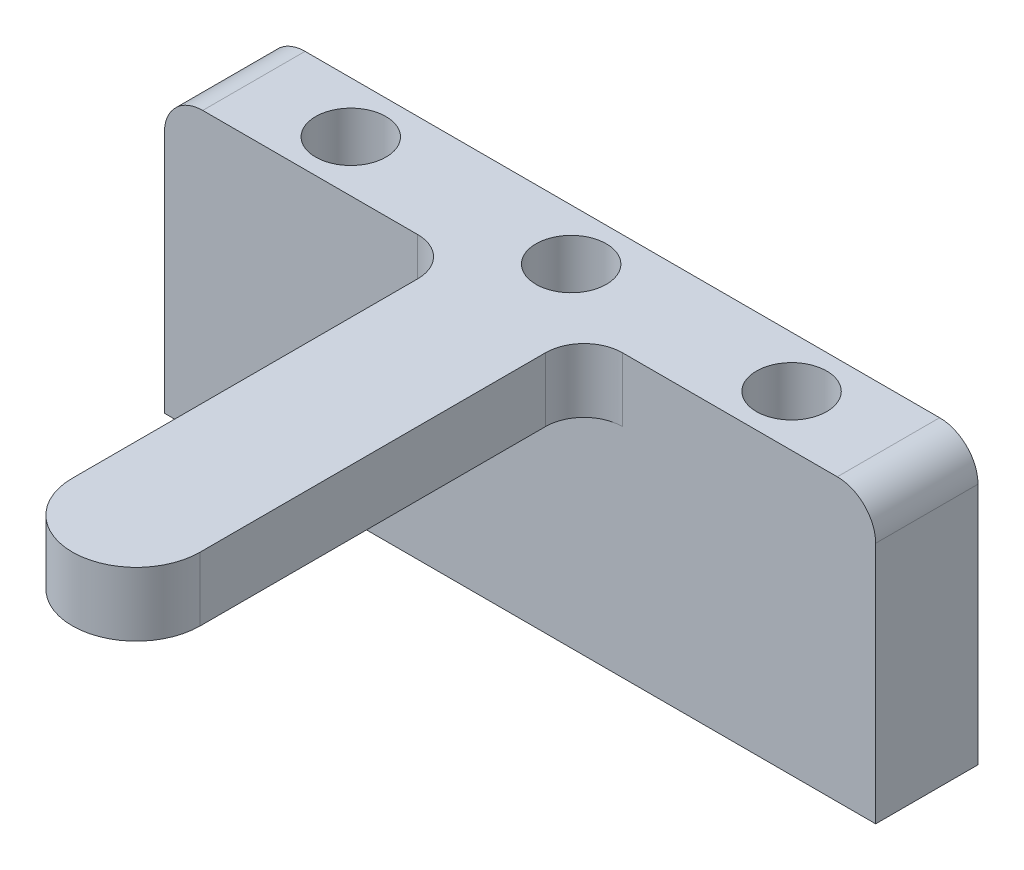
from build123d import *

# Parameters (mm, degrees)
SKETCH1_W           = 55.61
SKETCH1_H           = 8
SKETCH1_R           = 2.75
BOSS_EXTRUDE1_DEPTH = 22
SKETCH2_W           = 5
SKETCH2_H           = 5
BOSS_EXTRUDE2_DEPTH = 30
BOSS_EXTRUDE3_DEPTH = 5
FILLET1_R           = 3


with BuildPart() as part:
    # Sketch1 → Boss-Extrude1 (new body)
    with BuildSketch(Plane(origin=(0, 0, 0), x_dir=(1, 0, 0), z_dir=(0, 1, 0))):
        with Locations((27.805, 4)):
            Rectangle(SKETCH1_W, SKETCH1_H)
        with Locations(Location((27.805, 4, 0), (0, 0, 270))):
            Circle(SKETCH1_R, mode=Mode.SUBTRACT)
        with Locations(Location((10.575, 4, 0), (0, 0, 270))):
            Circle(SKETCH1_R, mode=Mode.SUBTRACT)
        with Locations(Location((45.035, 4, 0), (0, 0, 270))):
            Circle(SKETCH1_R, mode=Mode.SUBTRACT)
    extrude(amount=BOSS_EXTRUDE1_DEPTH)

    # Sketch2 → Boss-Extrude2 (add)
    with BuildSketch(Plane.XY):
        with Locations((25.305, 19.5)):
            Rectangle(SKETCH2_W, SKETCH2_H)
        with Locations((30.305, 19.5)):
            Rectangle(SKETCH2_W, SKETCH2_H)
    extrude(amount=BOSS_EXTRUDE2_DEPTH)

    # Sketch3 → Boss-Extrude3 (add)
    with BuildSketch(Plane(origin=(0, 22, 0), x_dir=(1, 0, 0), z_dir=(0, 1, 0))):
        with BuildLine():
            Line((22.805, -30), (32.805, -30))
            ThreePointArc((32.805, -30), (27.805, -35), (22.805, -30))
        make_face()
    extrude(amount=-BOSS_EXTRUDE3_DEPTH)

    # Fillet1
    fillet1_edges = [part.edges().sort_by_distance(p)[0] for p in [
        (55.61, 22, -4),
        (22.805, 19.5, 0),
        (32.805, 19.5, 0),
        (0, 22, -4),
    ]]
    fillet(fillet1_edges, radius=FILLET1_R)


solid = part.part
